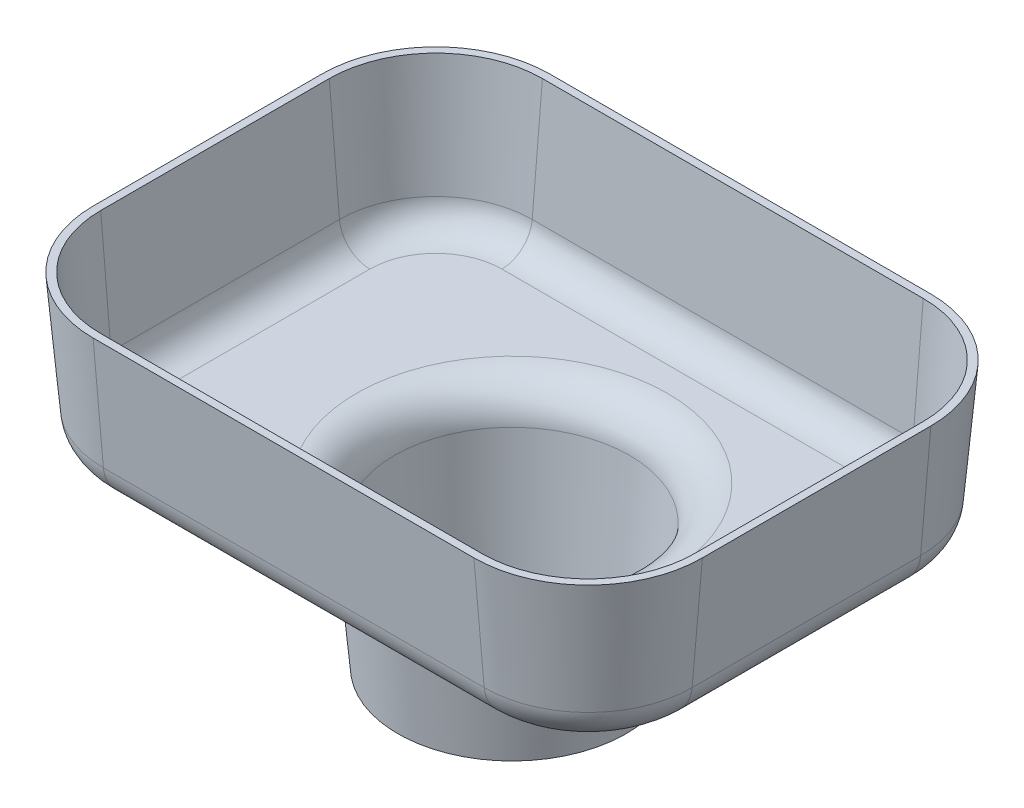
from build123d import *

# Parameters (mm, degrees)
BOSS_EXTRUDE1_DEPTH = 25.4
BOSS_EXTRUDE1_DRAFT = -5
BOSS_EXTRUDE2_REACH = 83.32
SKETCH3_R           = 19.05
BOSS_EXTRUDE2_DRAFT = 5
FILLET1_R           = 5.08
FILLET2_R           = 6.35
SHELL1_T            = -1.27


with BuildPart() as part:
    # Sketch1 → Boss-Extrude1 (with draft: the straight prism first)
    with BuildSketch(Plane(origin=(0, 0, 0), x_dir=(1, 0, 0), z_dir=(0, 1, 0))):
        with BuildLine():
            ThreePointArc((31.75, -38.1), (45.220384182, -32.520384182), (50.8, -19.05))
            Line((50.8, -19.05), (50.8, 19.05))
            ThreePointArc((50.8, 19.05), (45.220384182, 32.520384182), (31.75, 38.1))
            Line((31.75, 38.1), (-31.75, 38.1))
            ThreePointArc((-31.75, 38.1), (-45.220384182, 32.520384182), (-50.8, 19.05))
            Line((-50.8, 19.05), (-50.8, -19.05))
            ThreePointArc((-50.8, -19.05), (-45.220384182, -32.520384182), (-31.75, -38.1))
            Line((-31.75, -38.1), (31.75, -38.1))
        make_face()
    extrude(amount=-BOSS_EXTRUDE1_DEPTH)
    # Boss-Extrude1: the draft: its side faces are tilted about the plane it starts from
    boss_extrude1_sides = [part.faces().sort_by_distance(p)[0] for p in [
        (45.220384182, -12.7, 32.520384182),
        (50.8, -12.7, 0),
        (45.220384182, -12.7, -32.520384182),
        (0, -12.7, -38.1),
        (-45.220384182, -12.7, -32.520384182),
        (-50.8, -12.7, 0),
        (-45.220384182, -12.7, 32.520384182),
        (0, -12.7, 38.1),
    ]]
    draft(boss_extrude1_sides, Plane(origin=(0, 0, 0), x_dir=(1, 0, 0), z_dir=(0, 1, 0)), BOSS_EXTRUDE1_DRAFT)




with BuildPart() as boss_extrude2_long_prism_1:
    # Sketch3 → Boss-Extrude2 (the long prism of profile 1, to be tilted and cut off)
    with BuildSketch(Plane(origin=(0, -50.8, 0), x_dir=(-1, 0, 0), z_dir=(0, -1, 0))):
        Circle(SKETCH3_R)
    extrude(amount=-BOSS_EXTRUDE2_REACH)
    boss_extrude2_tool1_sides = [boss_extrude2_long_prism_1.faces().sort_by_distance(p)[0] for p in [
        (19.05, -9.14, 0),
    ]]
    draft(boss_extrude2_tool1_sides, Plane(origin=(0, -50.8, 0), x_dir=(-1, 0, 0), z_dir=(0, -1, 0)), BOSS_EXTRUDE2_DRAFT)  # the draft: side faces tilted about the start plane


with BuildPart() as part_1:
    add(part.part)
    boss_extrude2_tool1 = boss_extrude2_long_prism_1.part - part.part
    add(boss_extrude2_tool1.solids().sort_by_distance((0, -50.8, 0))[0])

    # Fillet1
    fillet1_edges = [part_1.edges().sort_by_distance(p)[0] for p in [
        (21.272212054, -25.4, 0),
    ]]
    fillet(fillet1_edges, radius=FILLET1_R)

    # Fillet2
    fillet2_edges = [part_1.edges().sort_by_distance(p)[0] for p in [
        (-43.649042969, -25.4, 30.949042969),
        (0, -25.4, 35.877787946),
        (43.649042969, -25.4, 30.949042969),
        (48.577787946, -25.4, 0),
        (43.649042969, -25.4, -30.949042969),
        (0, -25.4, -35.877787946),
        (-43.649042969, -25.4, -30.949042969),
        (-48.577787946, -25.4, 0),
    ]]
    fillet(fillet2_edges, radius=FILLET2_R)

    # Shell1
    shell1_openings = [part_1.faces().sort_by_distance(p)[0] for p in [
        (0, -50.8, 0),
        (0, 0, 0),
    ]]
    offset(amount=SHELL1_T, openings=shell1_openings, kind=Kind.INTERSECTION)


solid = part_1.part
